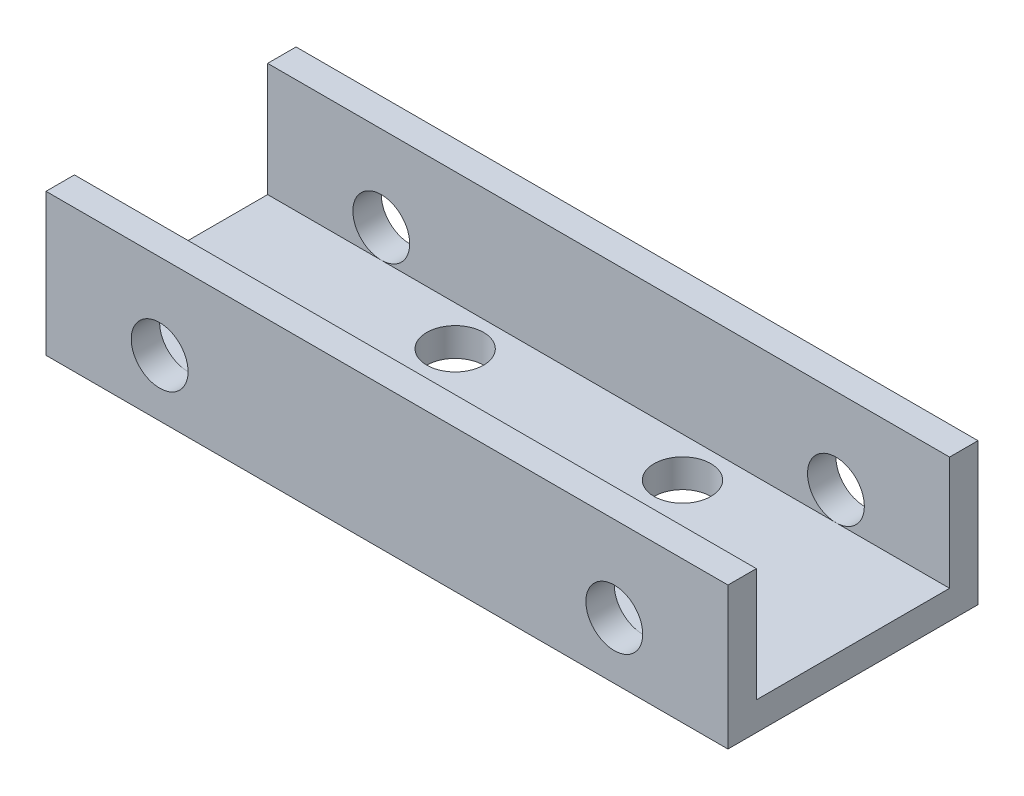
from build123d import *

# Parameters (mm, degrees)
SKETCH1_W           = 120
SKETCH1_H           = 44
BOSS_EXTRUDE1_DEPTH = 5
SKETCH2_W           = 120
SKETCH2_H           = 5
BOSS_EXTRUDE2_DEPTH = 20
SKETCH3_R           = 5
CUT_EXTRUDE1_DEPTH  = 79.492037813
SKETCH4_R           = 5
CUT_EXTRUDE3_DEPTH  = 67.962676171


with BuildPart() as part:
    # Sketch1 → Boss-Extrude1 (new body)
    with BuildSketch(Plane(origin=(0, 0, 0), x_dir=(1, 0, 0), z_dir=(0, 1, 0))):
        Rectangle(SKETCH1_W, SKETCH1_H)
    extrude(amount=BOSS_EXTRUDE1_DEPTH)

    # Sketch2 → Boss-Extrude2 (add)
    with BuildSketch(Plane(origin=(0, 5, 0), x_dir=(1, 0, 0), z_dir=(0, 1, 0))):
        with Locations((0, 19.5)):
            Rectangle(SKETCH2_W, SKETCH2_H)
        with Locations((0, -19.5)):
            Rectangle(SKETCH2_W, SKETCH2_H)
    extrude(amount=BOSS_EXTRUDE2_DEPTH)

    # Sketch3 → Cut-Extrude1 (cut, through all)
    with BuildSketch(Plane.XY.offset(22)):
        with Locations((40, 10)):
            Circle(SKETCH3_R)
        with Locations((-40, 10)):
            Circle(SKETCH3_R)
    extrude(amount=-CUT_EXTRUDE1_DEPTH, mode=Mode.SUBTRACT)

    # Sketch4 → Cut-Extrude3 (cut, through all)
    with BuildSketch(Plane(origin=(0, 5, 0), x_dir=(1, 0, 0), z_dir=(0, 1, 0))):
        with Locations(Location((20, 10, 0), (0, 0, 270))):
            Circle(SKETCH4_R)
        with Locations(Location((20, -10, 0), (0, 0, 270))):
            Circle(SKETCH4_R)
        with Locations(Location((-20, 10, 0), (0, 0, 270))):
            Circle(SKETCH4_R)
        with Locations(Location((-20, -10, 0), (0, 0, 270))):
            Circle(SKETCH4_R)
    extrude(amount=-CUT_EXTRUDE3_DEPTH, mode=Mode.SUBTRACT)


solid = part.part
